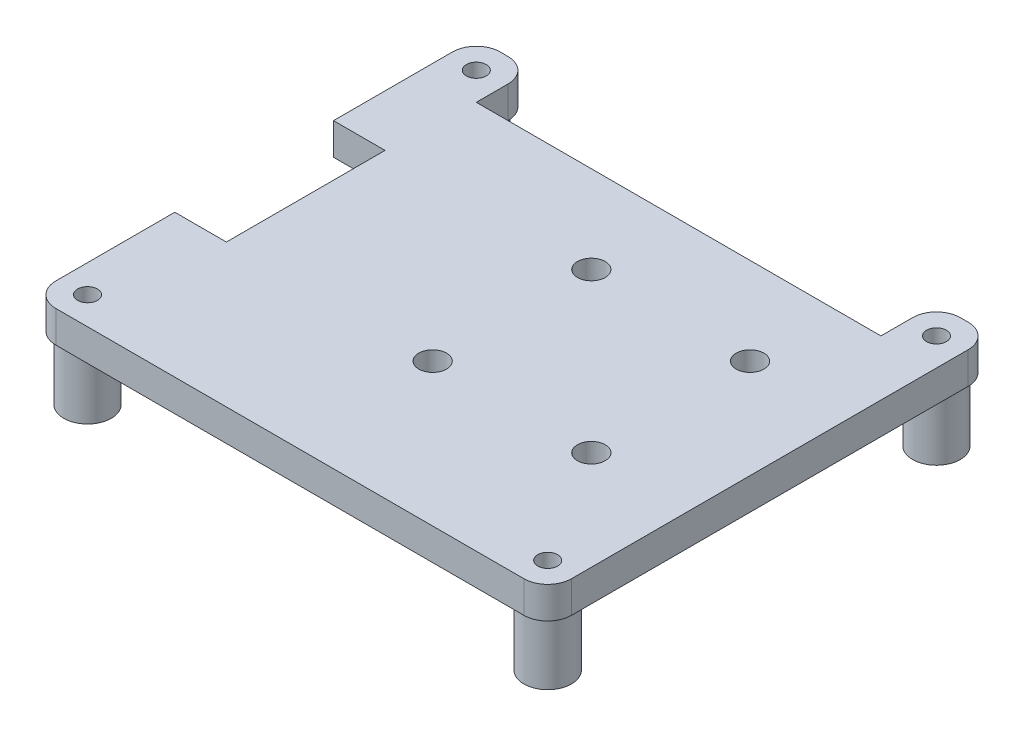
from build123d import *
from build123d.topology import SkipClean

# Parameters (mm, degrees)
SKETCH1_R           = 1.25
BOSS_EXTRUDE1_DEPTH = 4
FILLET1_R           = 3
SKETCH2_R           = 1.75
CUT_EXTRUDE1_DEPTH  = 4
BOSS_EXTRUDE2_START = 8
SKETCH3_R           = 3
SKETCH3_R_2         = 1.25
BOSS_EXTRUDE2_DEPTH = 8


with BuildPart() as part:
    # Sketch1 → Boss-Extrude1 (new body)
    with BuildSketch(Plane(origin=(0, 0, 0), x_dir=(1, 0, 0), z_dir=(0, 1, 0))):
        Polygon((-29.136771411, 14.21972047), (-29.136771411, 32.21972047), (-22.136771411, 32.21972047), (-22.136771411, 25.21972047), (28.863228589, 25.21972047), (28.863228589, 32.21972047), (35.863228589, 32.21972047), (35.863228589, -23.78027953), (-29.136771411, -23.78027953), (-29.136771411, -5.78027953), (-22.636771411, -5.78027953), (-22.636771411, 14.21972047), align=None)
        with Locations(Location((32.363228589, 28.71972047, 0), (0, 0, 270))):
            Circle(SKETCH1_R, mode=Mode.SUBTRACT)
        with Locations(Location((-25.636771411, 28.71972047, 0), (0, 0, 270))):
            Circle(SKETCH1_R, mode=Mode.SUBTRACT)
        with Locations(Location((32.363228589, -20.28027953, 0), (0, 0, 270))):
            Circle(SKETCH1_R, mode=Mode.SUBTRACT)
        with Locations(Location((-25.636771411, -20.28027953, 0), (0, 0, 270))):
            Circle(SKETCH1_R, mode=Mode.SUBTRACT)
    extrude(amount=BOSS_EXTRUDE1_DEPTH)

    # Fillet1
    fillet1_edges = [part.edges().sort_by_distance(p)[0] for p in [
        (-22.136771411, 2, -32.21972047),
        (28.863228589, 2, -32.21972047),
        (35.863228589, 2, -32.21972047),
        (35.863228589, 2, 23.78027953),
        (-29.136771411, 2, 23.78027953),
        (-29.136771411, 2, -32.21972047),
    ]]
    fillet(fillet1_edges, radius=FILLET1_R)

    # Sketch2 → Cut-Extrude1 (cut)
    with BuildSketch(Plane(origin=(0, 4, 0), x_dir=(1, 0, 0), z_dir=(0, 1, 0))):
        with Locations(Location((23.363228589, 14.21972047, 0), (0, 0, 270))):
            Circle(SKETCH2_R)
        with Locations(Location((3.363228589, 14.21972047, 0), (0, 0, 270))):
            Circle(SKETCH2_R)
        with Locations(Location((3.363228589, -5.78027953, 0), (0, 0, 270))):
            Circle(SKETCH2_R)
        with Locations(Location((23.363228589, -5.78027953, 0), (0, 0, 270))):
            Circle(SKETCH2_R)
    extrude(amount=-CUT_EXTRUDE1_DEPTH, mode=Mode.SUBTRACT)

    # Sketch3 → Boss-Extrude2 (add)
    # profile 1 of 4: a face of its own
    with SkipClean():  # the faces are left unmerged after this step: merging them gives an invalid solid
        with BuildSketch(Plane.XZ.offset(BOSS_EXTRUDE2_START)):
            with Locations(Location((-25.636771411, 20.28027953, 0), (0, 0, 270))):
                Circle(SKETCH3_R)
            with Locations(Location((-25.636771411, 20.28027953, 0), (0, 0, 270))):
                Circle(SKETCH3_R_2, mode=Mode.SUBTRACT)
        # profile 2 of 4: a face of its own
        with BuildSketch(Plane.XZ.offset(BOSS_EXTRUDE2_START)):
            with Locations(Location((-25.636771411, -28.71972047, 0), (0, 0, 270))):
                Circle(SKETCH3_R)
            with Locations(Location((-25.636771411, -28.71972047, 0), (0, 0, 270))):
                Circle(SKETCH3_R_2, mode=Mode.SUBTRACT)
        # profile 3 of 4: a face of its own
        with BuildSketch(Plane.XZ.offset(BOSS_EXTRUDE2_START)):
            with Locations(Location((32.363228589, -28.71972047, 0), (0, 0, 270))):
                Circle(SKETCH3_R)
            with Locations(Location((32.363228589, -28.71972047, 0), (0, 0, 270))):
                Circle(SKETCH3_R_2, mode=Mode.SUBTRACT)
        # profile 4 of 4: a face of its own
        with BuildSketch(Plane.XZ.offset(BOSS_EXTRUDE2_START)):
            with Locations(Location((32.363228589, 20.28027953, 0), (0, 0, 270))):
                Circle(SKETCH3_R)
            with Locations(Location((32.363228589, 20.28027953, 0), (0, 0, 270))):
                Circle(SKETCH3_R_2, mode=Mode.SUBTRACT)
        extrude(amount=-BOSS_EXTRUDE2_DEPTH)


solid = part.part
